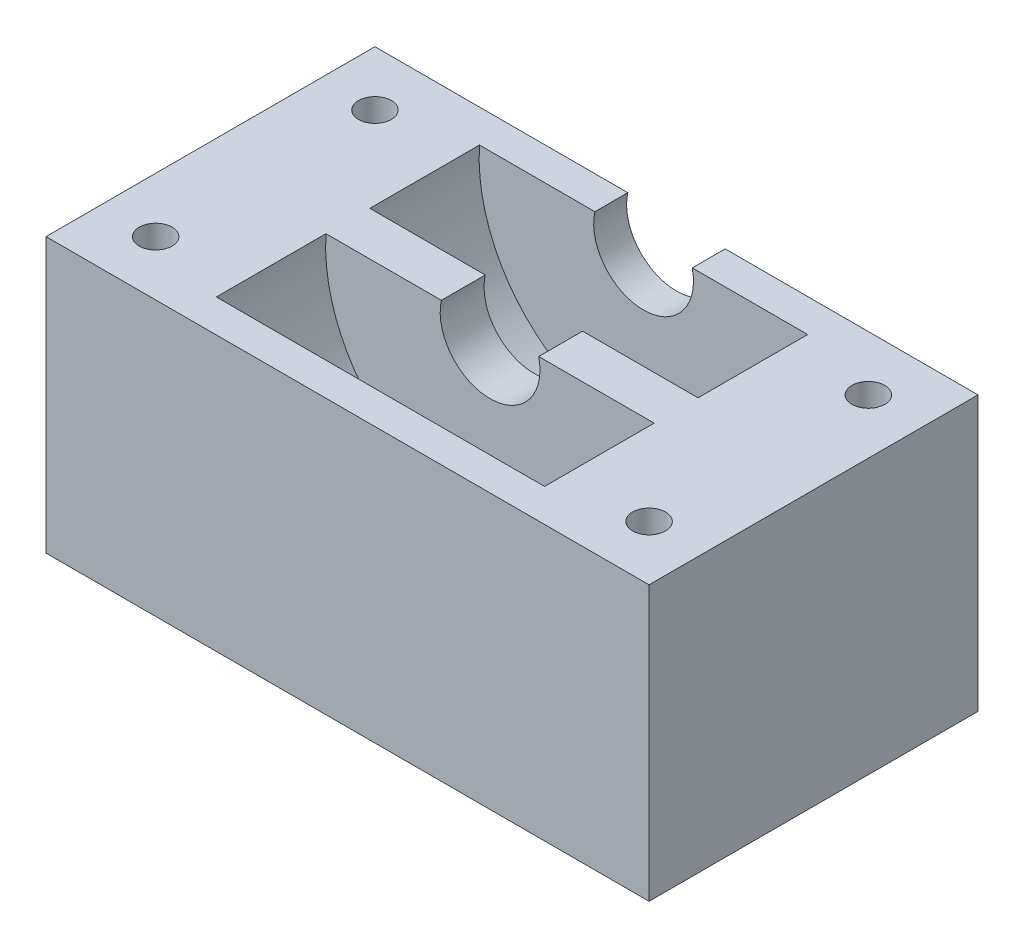
from build123d import *

# Parameters (mm, degrees)
SKETCH_2_R           = 15
EXTRUDE_1_DEPTH      = 10
EXTRUDE_START        = 10
EXTRUDE_2_DEPTH      = 10
SKETCH_4_R           = 15
EXTRUDE_3_DEPTH      = 10
SKETCH_5_R           = 4.55
CUT_EXTRUDE_1_DEPTH  = 43.804789452
SKETCH_6_R           = 1.5
CUT_EXTRUDE_2_DEPTH  = 56.213223054
SKETCH_7_R           = 15
CUT_EXTRUDE_3_DEPTH  = 13
CUT_EXTRUDE_START    = -3
SKETCH_8_R           = 15
CUT_EXTRUDE_4_DEPTH  = 3
SKETCH_10_W          = 10
SKETCH_10_H          = 30
SKETCH_10_R          = 1.5
EXTRUDE_5_DEPTH      = 45
EXTRUDE_6_REACH      = 62.467
EXTRUDE_6_END_RADIUS = 17.5
SKETCH_11_W          = 35
SKETCH_11_H          = 30
SKETCH_12_R          = 15
EXTRUDE_7_DEPTH      = 3
EXTRUDE_START_2      = -3
SKETCH_14_R          = 15
EXTRUDE_9_DEPTH      = 3
CUT_EXTRUDE_START_2  = -20
SKETCH_15_R          = 4.55
CUT_EXTRUDE_5_DEPTH  = 20
SKETCH_16_W          = 55
SKETCH_16_H          = 30
CUT_EXTRUDE_6_DEPTH  = 25
SKETCH_17_R          = 3
CUT_EXTRUDE_7_DEPTH  = 20


with BuildPart() as part:
    # 草图2 → 凸台-拉伸1 (new body)
    with BuildSketch(Plane.XY):
        with BuildLine():
            Line((-17.5, 21), (-17.5, 0))
            ThreePointArc((-17.5, 0), (0, -17.5), (17.5, 0))
            Line((17.5, 0), (17.5, 21))
            Line((17.5, 21), (27.5, 21))
            Line((27.5, 21), (27.5, 26))
            Line((27.5, 26), (-27.5, 26))
            Line((-27.5, 26), (-27.5, 21))
            Line((-27.5, 21), (-17.5, 21))
        make_face()
        Circle(SKETCH_2_R, mode=Mode.SUBTRACT)
    extrude(amount=EXTRUDE_1_DEPTH)

    # 草图3 → 凸台-拉伸2 (add)
    with BuildSketch(Plane(origin=(0, 0, 0), x_dir=(-1, 0, 0), z_dir=(0, 0, -1)).offset(EXTRUDE_START)):
        with BuildLine():
            Line((17.5, 0), (17.5, 21))
            Line((17.5, 21), (27.5, 21))
            Line((27.5, 21), (27.5, 26))
            Line((27.5, 26), (-27.5, 26))
            Line((-27.5, 26), (-27.5, 21))
            Line((-27.5, 21), (-17.5, 21))
            Line((-17.5, 21), (-17.5, 0))
            ThreePointArc((-17.5, 0), (0, -17.5), (17.5, 0))
        make_face()
    extrude(amount=-EXTRUDE_2_DEPTH)

    # 草图4 → 凸台-拉伸3 (add)
    with BuildSketch(Plane(origin=(0, 0, -10), x_dir=(-1, 0, 0), z_dir=(0, 0, -1)).offset(EXTRUDE_START)):
        with BuildLine():
            Line((17.5, 0), (17.5, 21))
            Line((17.5, 21), (27.5, 21))
            Line((27.5, 21), (27.5, 26))
            Line((27.5, 26), (-27.5, 26))
            Line((-27.5, 26), (-27.5, 21))
            Line((-27.5, 21), (-17.5, 21))
            Line((-17.5, 21), (-17.5, 0))
            ThreePointArc((-17.5, 0), (0, -17.5), (17.5, 0))
        make_face()
        Circle(SKETCH_4_R, mode=Mode.SUBTRACT)
    extrude(amount=-EXTRUDE_3_DEPTH)

    # 草图5 → 切除-拉伸1 (cut, through all)
    with BuildSketch(Plane.XY):
        Circle(SKETCH_5_R)
    extrude(amount=-CUT_EXTRUDE_1_DEPTH, mode=Mode.SUBTRACT)

    # 草图6 → 切除-拉伸2 (cut, through all)
    with BuildSketch(Plane(origin=(0, 26, 0), x_dir=(1, 0, 0), z_dir=(0, 1, 0))):
        with Locations((-22.5, 15)):
            Circle(SKETCH_6_R)
        with Locations((-22.5, -5)):
            Circle(SKETCH_6_R)
        with Locations((22.5, 15)):
            Circle(SKETCH_6_R)
        with Locations((22.5, -5)):
            Circle(SKETCH_6_R)
    extrude(amount=-CUT_EXTRUDE_2_DEPTH, mode=Mode.SUBTRACT)

    # 草图7 → 切除-拉伸3 (cut)
    with BuildSketch(Plane(origin=(0, 0, -20), x_dir=(-1, 0, 0), z_dir=(0, 0, -1))):
        Circle(SKETCH_7_R)
    extrude(amount=-CUT_EXTRUDE_3_DEPTH, mode=Mode.SUBTRACT)

    # 草图8 → 切除-拉伸4 (cut)
    with BuildSketch(Plane.XY.offset(CUT_EXTRUDE_START)):
        Circle(SKETCH_8_R)
    extrude(amount=CUT_EXTRUDE_4_DEPTH, mode=Mode.SUBTRACT)

    # 草图10 → 凸台-拉伸5 (add)
    # profile 1 of 2: a face of its own
    with BuildSketch(Plane.XZ.offset(-21)):
        with Locations((22.5, -5)):
            Rectangle(SKETCH_10_W, SKETCH_10_H)
        with Locations((22.5, -15)):
            Circle(SKETCH_10_R, mode=Mode.SUBTRACT)
        with Locations((22.5, 5)):
            Circle(SKETCH_10_R, mode=Mode.SUBTRACT)
    # profile 2 of 2: a face of its own
    with BuildSketch(Plane.XZ.offset(-21)):
        with Locations((-22.5, -5)):
            Rectangle(SKETCH_10_W, SKETCH_10_H)
        with Locations((-22.5, 5)):
            Circle(SKETCH_10_R, mode=Mode.SUBTRACT)
        with Locations((-22.5, -15)):
            Circle(SKETCH_10_R, mode=Mode.SUBTRACT)
    extrude(amount=EXTRUDE_5_DEPTH)

    # 凸台-拉伸6: up to this cylinder (the profile starts outside it)
    extrude_6_end = Plane(origin=(0, 0, -5), z_dir=(0, 0, -1)) * Cylinder(EXTRUDE_6_END_RADIUS, 160.934, mode=Mode.PRIVATE)
    # 草图11 → 凸台-拉伸6 (add, up to the surface)
    with BuildSketch(Plane.XZ.offset(24), mode=Mode.PRIVATE) as extrude_6_sk1:
        with Locations((0, -5)):
            Rectangle(SKETCH_11_W, SKETCH_11_H)
    extrude_6_tool1 = extrude(extrude_6_sk1.sketch, amount=-EXTRUDE_6_REACH, mode=Mode.PRIVATE) - extrude_6_end
    add(extrude_6_tool1.solids().sort_by_distance((0, -24, -5))[0])

    # 草图12 → 凸台-拉伸7 (add)
    with BuildSketch(Plane(origin=(0, 0, -20), x_dir=(-1, 0, 0), z_dir=(0, 0, -1))):
        Circle(SKETCH_12_R)
    extrude(amount=-EXTRUDE_7_DEPTH)

    # 草图14 → 凸台-拉伸9 (add)
    with BuildSketch(Plane.XY.offset(10).offset(EXTRUDE_START_2)):
        Circle(SKETCH_14_R)
    extrude(amount=EXTRUDE_9_DEPTH)

    # 草图15 → 切除-拉伸5 (cut)
    with BuildSketch(Plane(origin=(0, 0, -20), x_dir=(-1, 0, 0), z_dir=(0, 0, -1)).offset(CUT_EXTRUDE_START_2)):
        Circle(SKETCH_15_R)
    extrude(amount=CUT_EXTRUDE_5_DEPTH, mode=Mode.SUBTRACT)

    # 草图16 → 切除-拉伸6 (cut)
    with BuildSketch(Plane(origin=(0, 26, 0), x_dir=(1, 0, 0), z_dir=(0, 1, 0))):
        with Locations((0, 5)):
            Rectangle(SKETCH_16_W, SKETCH_16_H)
    extrude(amount=-CUT_EXTRUDE_6_DEPTH, mode=Mode.SUBTRACT)

    # 草图17 → 切除-拉伸7 (cut)
    with BuildSketch(Plane.XZ.offset(24)):
        with Locations((-22.5, 5)):
            Circle(SKETCH_17_R)
        with Locations((-22.5, -15)):
            Circle(SKETCH_17_R)
        with Locations((22.5, 5)):
            Circle(SKETCH_17_R)
        with Locations((22.5, -15)):
            Circle(SKETCH_17_R)
    extrude(amount=-CUT_EXTRUDE_7_DEPTH, mode=Mode.SUBTRACT)


solid = part.part
